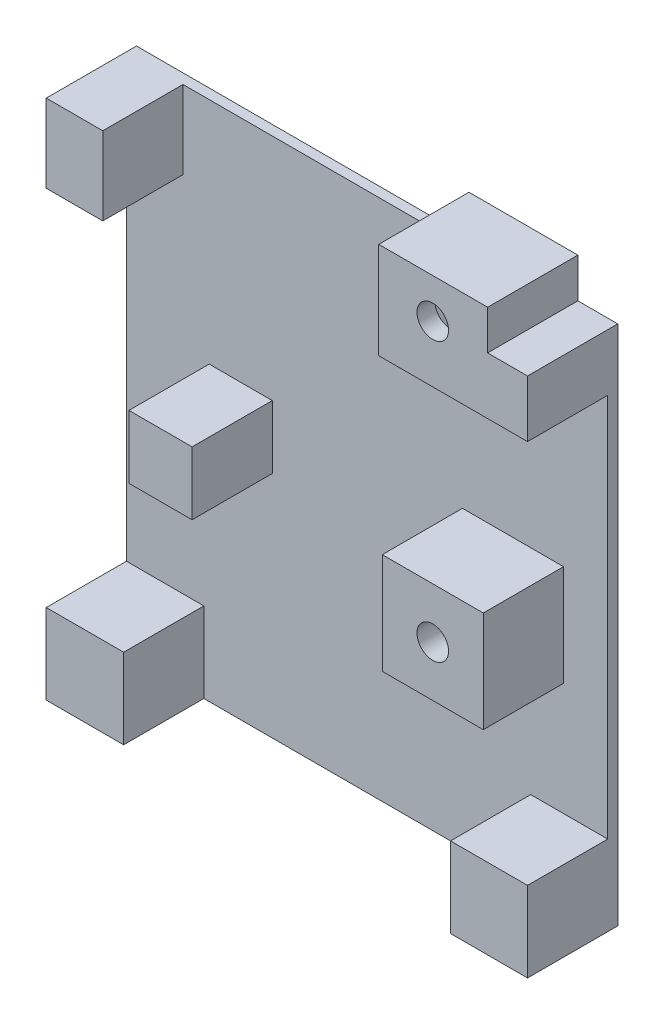
from build123d import *

# Parameters (mm, degrees)
SKETCH1_W            = 76.2
SKETCH1_H            = 76.2
BOSS_EXTRUDE1_DEPTH  = 1.5875
SKETCH3_W            = 6.35
SKETCH3_H            = 3.175
SKETCH3_W_2          = 3.175
SKETCH3_H_2          = 6.35
BOSS_EXTRUDE2_DEPTH  = 12.7
SKETCH4_W            = 6.35
SKETCH4_H            = 14.2875
BOSS_EXTRUDE3_DEPTH  = 7.62
SKETCH5_W            = 14.2875
SKETCH5_H            = 6.35
BOSS_EXTRUDE4_DEPTH  = 7.62
SKETCH6_W            = 14.2875
SKETCH6_H            = 6.35
BOSS_EXTRUDE5_DEPTH  = 7.62
SKETCH7_R            = 1.984375
CUT_EXTRUDE2_DEPTH   = 67.217591743
BOSS_EXTRUDE6_DEPTH  = 76.2
CUT_EXTRUDE3_REACH   = 89.333
SKETCH9_W            = 63.5
SKETCH9_H            = 12.7
BOSS_EXTRUDE7_DEPTH  = 6.35
BOSS_EXTRUDE8_DEPTH  = 6.35
SKETCH12_W           = 7.62
SKETCH12_H           = 12.7
SKETCH12_R           = 1.984375
CUT_EXTRUDE4_DEPTH   = 30.48
SKETCH13_W           = 6.35
SKETCH13_H           = 7.62
CUT_EXTRUDE5_DEPTH   = 30.48
SKETCH15_W           = 6.35
SKETCH15_H           = 12.7
CUT_EXTRUDE6_DEPTH   = 30.48
BOSS_EXTRUDE9_DEPTH  = 14.2875
SKETCH17_R           = 2.5
CUT_EXTRUDE7_DEPTH   = 24.9555
SKETCH18_R           = 2.5
CUT_EXTRUDE8_DEPTH   = 11.43
BOSS_EXTRUDE10_DEPTH = 3.556
SKETCH20_W           = 16
SKETCH20_H           = 16
SKETCH20_R           = 2.5
BOSS_EXTRUDE11_DEPTH = 14.2875
SKETCH21_R           = 2.5
CUT_EXTRUDE9_DEPTH   = 31.0515
SKETCH22_R           = 2.5
CUT_EXTRUDE10_DEPTH  = 10.16
SKETCH23_W           = 23.556
SKETCH23_H           = 14.2875
BOSS_EXTRUDE12_DEPTH = 1.27
SKETCH24_W           = 6.35
SKETCH24_H           = 7.62
CUT_EXTRUDE11_DEPTH  = 30.988
SKETCH25_W           = 7.62
SKETCH25_H           = 12.7
CUT_EXTRUDE12_DEPTH  = 30.988
SKETCH26_W           = 12.7
SKETCH26_H           = 12.7
BOSS_EXTRUDE13_DEPTH = 12.192
SKETCH28_W           = 12.7
SKETCH28_H           = 12.7
BOSS_EXTRUDE15_DEPTH = 12.2555
SKETCH29_W           = 12.7
SKETCH29_H           = 12.367297847
BOSS_EXTRUDE16_DEPTH = 8.9535
SKETCH30_W           = 6.317197846
SKETCH30_H           = 6.27
CUT_EXTRUDE13_DEPTH  = 32.8295
SKETCH27_W           = 10
SKETCH27_H           = 10
BOSS_EXTRUDE17_DEPTH = 14.2875


with BuildPart() as part:
    # Sketch1 → Boss-Extrude1 (new body)
    with BuildSketch(Plane.XY):
        Rectangle(SKETCH1_W, SKETCH1_H)
    extrude(amount=BOSS_EXTRUDE1_DEPTH)

    # Sketch3 → Boss-Extrude2 (add)
    with BuildSketch(Plane.XY.offset(1.5875)):
        with Locations((-34.925, 36.5125)):
            Rectangle(SKETCH3_W, SKETCH3_H)
        with Locations((34.925, 36.5125)):
            Rectangle(SKETCH3_W, SKETCH3_H)
        with Locations((-36.5125, -34.925)):
            Rectangle(SKETCH3_W_2, SKETCH3_H_2)
        with Locations((36.5125, -34.925)):
            Rectangle(SKETCH3_W_2, SKETCH3_H_2)
    extrude(amount=BOSS_EXTRUDE2_DEPTH)

    # Sketch4 → Boss-Extrude3 (add)
    with BuildSketch(Plane(origin=(0, 38.1, 0), x_dir=(1, 0, 0), z_dir=(0, 1, 0))):
        with Locations((-34.925, -7.14375)):
            Rectangle(SKETCH4_W, SKETCH4_H)
        with Locations((34.925, -7.14375)):
            Rectangle(SKETCH4_W, SKETCH4_H)
    extrude(amount=BOSS_EXTRUDE3_DEPTH)

    # Sketch5 → Boss-Extrude4 (add)
    with BuildSketch(Plane(origin=(38.1, 0, 0), x_dir=(0, 0, -1), z_dir=(1, 0, 0))):
        with Locations((-7.14375, -34.925)):
            Rectangle(SKETCH5_W, SKETCH5_H)
    extrude(amount=BOSS_EXTRUDE4_DEPTH)

    # Sketch6 → Boss-Extrude5 (add)
    with BuildSketch(Plane.ZY.offset(38.1)):
        with Locations((7.14375, -34.925)):
            Rectangle(SKETCH6_W, SKETCH6_H)
    extrude(amount=BOSS_EXTRUDE5_DEPTH)

    # Sketch7 → Cut-Extrude2 (cut, through all)
    with BuildSketch(Plane(origin=(0, 0, 0), x_dir=(-1, 0, 0), z_dir=(0, 0, -1))):
        with Locations((-34.925, 41.39168957)):
            Circle(SKETCH7_R)
        with Locations((34.925, 41.39168957)):
            Circle(SKETCH7_R)
        with Locations((-41.275, -34.925)):
            Circle(SKETCH7_R)
        with Locations((41.275, -34.925)):
            Circle(SKETCH7_R)
    extrude(amount=-CUT_EXTRUDE2_DEPTH, mode=Mode.SUBTRACT)

    # Sketch8 → Boss-Extrude6 (add)
    with BuildSketch(Plane.ZY.offset(38.1)):
        Polygon((1.5875, 25.732702153), (14.2875, 34.925), (1.5875, 34.925), align=None)
    extrude(amount=-BOSS_EXTRUDE6_DEPTH)

    # Sketch9 → Cut-Extrude3 (cut, up to next)
    with BuildSketch(Plane(origin=(0, 34.925, 0), x_dir=(1, 0, 0), z_dir=(0, 1, 0)), mode=Mode.PRIVATE) as cut_extrude3_sk1:
        with Locations((0, -7.9375)):
            Rectangle(SKETCH9_W, SKETCH9_H)
    cut_extrude3_tool1 = extrude(cut_extrude3_sk1.sketch, amount=-CUT_EXTRUDE3_REACH, mode=Mode.PRIVATE) & part.part
    add(cut_extrude3_tool1.solids().sort_by_distance((0, 34.925, 7.9375))[0], mode=Mode.SUBTRACT)

    # Sketch10 → Boss-Extrude7 (add)
    with BuildSketch(Plane.XZ.offset(38.1)):
        Polygon((-26.257396371, 1.5875), (-34.925, 14.2875), (-34.925, 1.5875), align=None)
        Polygon((34.925, 14.2875), (26.257396371, 1.5875), (34.925, 1.5875), align=None)
    extrude(amount=-BOSS_EXTRUDE7_DEPTH)

    # Sketch11 → Boss-Extrude8 (add)
    with BuildSketch(Plane.XZ.offset(38.1)):
        Polygon((-45.72, 14.2875), (-45.72, 0), (45.72, 0), (45.72, 14.2875), (34.925, 14.2875), (26.257396371, 1.5875), (-26.257396371, 1.5875), (-34.925, 14.2875), align=None)
    extrude(amount=BOSS_EXTRUDE8_DEPTH)

    # Sketch12 → Cut-Extrude4 (cut)
    with BuildSketch(Plane(origin=(0, 0, 0), x_dir=(-1, 0, 0), z_dir=(0, 0, -1))):
        with Locations((-41.91, -38.1)):
            Rectangle(SKETCH12_W, SKETCH12_H)
        with Locations((-41.275, -34.925)):
            Circle(SKETCH12_R, mode=Mode.SUBTRACT)
    extrude(amount=-CUT_EXTRUDE4_DEPTH, mode=Mode.SUBTRACT)

    # Sketch13 → Cut-Extrude5 (cut)
    with BuildSketch(Plane(origin=(0, 0, 0), x_dir=(-1, 0, 0), z_dir=(0, 0, -1))):
        with Locations((-34.925, 41.91)):
            Rectangle(SKETCH13_W, SKETCH13_H)
    extrude(amount=-CUT_EXTRUDE5_DEPTH, mode=Mode.SUBTRACT)

    # Sketch15 → Cut-Extrude6 (cut)
    with BuildSketch(Plane(origin=(0, 38.1, 0), x_dir=(1, 0, 0), z_dir=(0, 1, 0))):
        with Locations((34.925, -7.9375)):
            Rectangle(SKETCH15_W, SKETCH15_H)
    extrude(amount=-CUT_EXTRUDE6_DEPTH, mode=Mode.SUBTRACT)

    # Sketch16 → Boss-Extrude9 (add)
    with BuildSketch(Plane(origin=(0, 0, 0), x_dir=(-1, 0, 0), z_dir=(0, 0, -1))):
        Polygon((-38.1, 38.1), (-38.1, 43.1), (-18.1, 43.1), (-18.1, 29.1), (-38.1, 29.1), align=None)
    extrude(amount=-BOSS_EXTRUDE9_DEPTH)

    # Sketch17 → Cut-Extrude7 (cut)
    with BuildSketch(Plane(origin=(0, 0, 0), x_dir=(-1, 0, 0), z_dir=(0, 0, -1))):
        with Locations((-23.1, 38.1)):
            Circle(SKETCH17_R)
    extrude(amount=-CUT_EXTRUDE7_DEPTH, mode=Mode.SUBTRACT)

    # Sketch18 → Cut-Extrude8 (cut)
    with BuildSketch(Plane(origin=(0, 0, 0), x_dir=(-1, 0, 0), z_dir=(0, 0, -1))):
        Polygon((-25.409401077, 34.1), (-20.790598923, 34.1), (-18.481197846, 38.1), (-20.790598923, 42.1), (-25.409401077, 42.1), (-27.718802154, 38.1), align=None)
        with Locations((-23.1, 38.1)):
            Circle(SKETCH18_R, mode=Mode.SUBTRACT)
    extrude(amount=-CUT_EXTRUDE8_DEPTH, mode=Mode.SUBTRACT)

    # Sketch19 → Boss-Extrude10 (add)
    with BuildSketch(Plane.ZY.offset(-18.1)):
        Polygon((1.5875, 29.1), (14.2875, 29.1), (14.2875, 43.1), (0, 43.1), (0, 38.1), (1.5875, 38.1), align=None)
    extrude(amount=BOSS_EXTRUDE10_DEPTH)

    # Sketch20 → Boss-Extrude11 (add)
    with BuildSketch(Plane(origin=(0, 0, 0), x_dir=(-1, 0, 0), z_dir=(0, 0, -1))):
        with Locations((-23.1, -5.9)):
            Rectangle(SKETCH20_W, SKETCH20_H)
        with Locations((-23.1, -5.9)):
            Circle(SKETCH20_R, mode=Mode.SUBTRACT)
    extrude(amount=-BOSS_EXTRUDE11_DEPTH)

    # Sketch21 → Cut-Extrude9 (cut)
    with BuildSketch(Plane(origin=(0, 0, 0), x_dir=(-1, 0, 0), z_dir=(0, 0, -1))):
        with Locations((-23.1, -5.9)):
            Circle(SKETCH21_R)
    extrude(amount=-CUT_EXTRUDE9_DEPTH, mode=Mode.SUBTRACT)

    # Sketch22 → Cut-Extrude10 (cut)
    with BuildSketch(Plane(origin=(0, 0, 0), x_dir=(-1, 0, 0), z_dir=(0, 0, -1))):
        Polygon((-25.409401077, -9.9), (-20.790598923, -9.9), (-18.481197846, -5.9), (-20.790598923, -1.9), (-25.409401077, -1.9), (-27.718802154, -5.9), align=None)
        with Locations((-23.1, -5.9)):
            Circle(SKETCH22_R, mode=Mode.SUBTRACT)
    extrude(amount=-CUT_EXTRUDE10_DEPTH, mode=Mode.SUBTRACT)

    # Sketch23 → Boss-Extrude12 (add)
    with BuildSketch(Plane(origin=(0, 43.1, 0), x_dir=(1, 0, 0), z_dir=(0, 1, 0))):
        with Locations((26.322, -7.14375)):
            Rectangle(SKETCH23_W, SKETCH23_H)
    extrude(amount=BOSS_EXTRUDE12_DEPTH)

    # Sketch24 → Cut-Extrude11 (cut)
    with BuildSketch(Plane(origin=(0, 0, 0), x_dir=(-1, 0, 0), z_dir=(0, 0, -1))):
        with Locations((34.925, 41.91)):
            Rectangle(SKETCH24_W, SKETCH24_H)
    extrude(amount=-CUT_EXTRUDE11_DEPTH, mode=Mode.SUBTRACT)

    # Sketch25 → Cut-Extrude12 (cut)
    with BuildSketch(Plane(origin=(0, 0, 0), x_dir=(-1, 0, 0), z_dir=(0, 0, -1))):
        with Locations((41.91, -38.1)):
            Rectangle(SKETCH25_W, SKETCH25_H)
    extrude(amount=-CUT_EXTRUDE12_DEPTH, mode=Mode.SUBTRACT)

    # Sketch26 → Boss-Extrude13 (add)
    with BuildSketch(Plane(origin=(38.1, 0, 0), x_dir=(0, 0, -1), z_dir=(1, 0, 0))):
        with Locations((-7.9375, -38.1)):
            Rectangle(SKETCH26_W, SKETCH26_H)
    extrude(amount=-BOSS_EXTRUDE13_DEPTH)

    # Sketch28 → Boss-Extrude15 (add)
    with BuildSketch(Plane.ZY.offset(38.1)):
        with Locations((7.9375, -38.1)):
            Rectangle(SKETCH28_W, SKETCH28_H)
    extrude(amount=-BOSS_EXTRUDE15_DEPTH)

    # Sketch29 → Boss-Extrude16 (add)
    with BuildSketch(Plane.ZY.offset(38.1)):
        with Locations((7.9375, 31.916351076)):
            Rectangle(SKETCH29_W, SKETCH29_H)
    extrude(amount=-BOSS_EXTRUDE16_DEPTH)

    # Sketch30 → Cut-Extrude13 (cut)
    with BuildSketch(Plane(origin=(0, 0, 0), x_dir=(-1, 0, 0), z_dir=(0, 0, -1))):
        with Locations((-34.941401077, 41.235)):
            Rectangle(SKETCH30_W, SKETCH30_H)
    extrude(amount=-CUT_EXTRUDE13_DEPTH, mode=Mode.SUBTRACT)

    # Sketch27 → Boss-Extrude17 (add)
    with BuildSketch(Plane(origin=(0, 0, 0), x_dir=(-1, 0, 0), z_dir=(0, 0, -1))):
        with Locations((20.007888644, -3.175)):
            Rectangle(SKETCH27_W, SKETCH27_H)
    extrude(amount=-BOSS_EXTRUDE17_DEPTH)


solid = part.part
